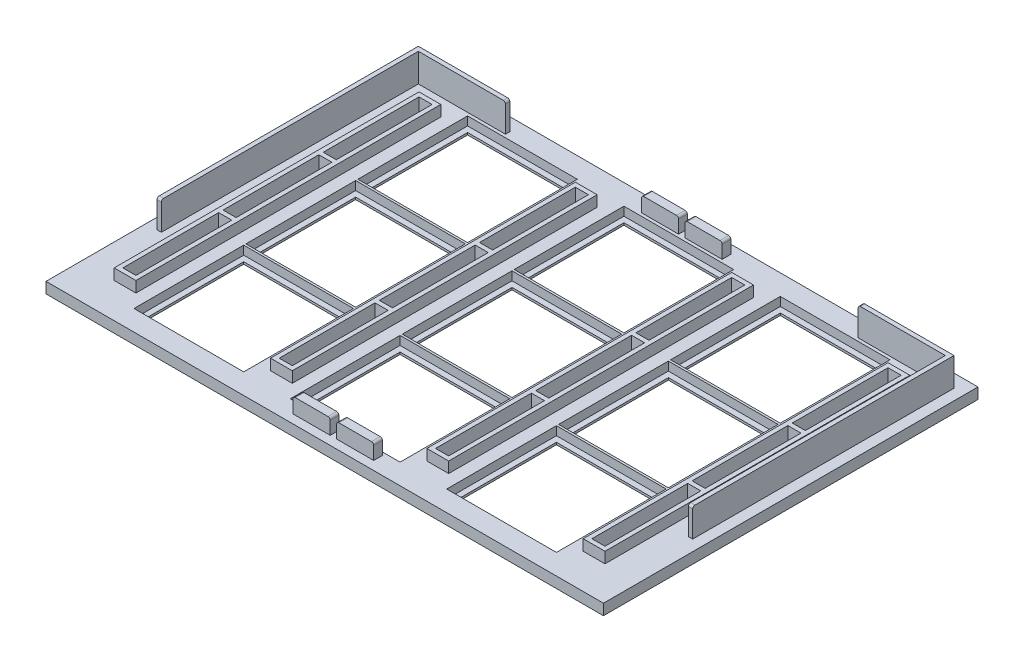
from build123d import *

# Parameters (mm, degrees)
SKETCH2_W           = 128
SKETCH2_H           = 86
BOSS_EXTRUDE1_DEPTH = 2.5
SKETCH3_W           = 25.2
SKETCH3_H           = 25.2
SKETCH3_H_2         = 12.6
CUT_EXTRUDE1_DEPTH  = 2
SKETCH4_W           = 22.6
SKETCH4_H           = 22.6
CUT_EXTRUDE2_DEPTH  = 2.5
SKETCH5_W           = 5
SKETCH5_H           = 70
BOSS_EXTRUDE2_DEPTH = 2.5
SKETCH7_W           = 3
SKETCH7_H           = 22
CUT_EXTRUDE6_DEPTH  = 3
SKETCH9_W           = 8.5
SKETCH9_H           = 2
BOSS_EXTRUDE3_DEPTH = 6.5
CUT_EXTRUDE9_START  = 3.5
SKETCH10_W          = 8.5
SKETCH10_H          = 2
CUT_EXTRUDE9_DEPTH  = 74.877322259
FILLET1_R           = 0.5


with BuildPart() as part:
    # Sketch2 → Boss-Extrude1 (new body)
    with BuildSketch(Plane(origin=(0, 0, 0), x_dir=(1, 0, 0), z_dir=(0, 1, 0))):
        Rectangle(SKETCH2_W, SKETCH2_H)
    extrude(amount=-BOSS_EXTRUDE1_DEPTH)

    # Sketch3 → Cut-Extrude1 (cut)
    with BuildSketch(Plane(origin=(0, 0, 0), x_dir=(1, 0, 0), z_dir=(0, 1, 0))):
        with Locations((0, 25.7)):
            Rectangle(SKETCH3_W, SKETCH3_H)
        with Locations((35.9, 25.7)):
            Rectangle(SKETCH3_W, SKETCH3_H)
        with Locations((35.9, 6.3)):
            Rectangle(SKETCH3_W, SKETCH3_H_2)
        with Locations((35.9, -6.3)):
            Rectangle(SKETCH3_W, SKETCH3_H_2)
        with Locations((35.9, -25.7)):
            Rectangle(SKETCH3_W, SKETCH3_H)
        with Locations((0, 6.3)):
            Rectangle(SKETCH3_W, SKETCH3_H_2)
        with Locations((0, -6.3)):
            Rectangle(SKETCH3_W, SKETCH3_H_2)
        with Locations((0, -25.7)):
            Rectangle(SKETCH3_W, SKETCH3_H)
        with Locations((-35.9, 25.7)):
            Rectangle(SKETCH3_W, SKETCH3_H)
        with Locations((-35.9, 6.3)):
            Rectangle(SKETCH3_W, SKETCH3_H_2)
        with Locations((-35.9, -6.3)):
            Rectangle(SKETCH3_W, SKETCH3_H_2)
        with Locations((-35.9, -25.7)):
            Rectangle(SKETCH3_W, SKETCH3_H)
    extrude(amount=-CUT_EXTRUDE1_DEPTH, mode=Mode.SUBTRACT)

    # Sketch4 → Cut-Extrude2 (cut)
    with BuildSketch(Plane(origin=(0, 0, 0), x_dir=(1, 0, 0), z_dir=(0, 1, 0))):
        Rectangle(SKETCH4_W, SKETCH4_H)
        with Locations((0, 25.7)):
            Rectangle(SKETCH4_W, SKETCH4_H)
        with Locations((0, -25.7)):
            Rectangle(SKETCH4_W, SKETCH4_H)
        with Locations((35.9, -25.7)):
            Rectangle(SKETCH4_W, SKETCH4_H)
        with Locations((35.9, 0)):
            Rectangle(SKETCH4_W, SKETCH4_H)
        with Locations((35.9, 25.7)):
            Rectangle(SKETCH4_W, SKETCH4_H)
        with Locations((-35.9, -25.7)):
            Rectangle(SKETCH4_W, SKETCH4_H)
        with Locations((-35.9, 0)):
            Rectangle(SKETCH4_W, SKETCH4_H)
        with Locations((-35.9, 25.7)):
            Rectangle(SKETCH4_W, SKETCH4_H)
    extrude(amount=-CUT_EXTRUDE2_DEPTH, mode=Mode.SUBTRACT)

    # Sketch5 → Boss-Extrude2 (add)
    with BuildSketch(Plane(origin=(0, 0, 0), x_dir=(1, 0, 0), z_dir=(0, 1, 0))):
        with Locations((-53.85, 0)):
            Rectangle(SKETCH5_W, SKETCH5_H)
        with Locations((-17.95, 0)):
            Rectangle(SKETCH5_W, SKETCH5_H)
        with Locations((17.95, 0)):
            Rectangle(SKETCH5_W, SKETCH5_H)
        with Locations((53.85, 0)):
            Rectangle(SKETCH5_W, SKETCH5_H)
    extrude(amount=BOSS_EXTRUDE2_DEPTH)

    # Sketch7 → Cut-Extrude6 (cut)
    with BuildSketch(Plane(origin=(0, 2.5, 0), x_dir=(1, 0, 0), z_dir=(0, 1, 0))):
        with Locations((-17.95, 23)):
            Rectangle(SKETCH7_W, SKETCH7_H)
        with Locations((-17.95, 0)):
            Rectangle(SKETCH7_W, SKETCH7_H)
        with Locations((-17.95, -23)):
            Rectangle(SKETCH7_W, SKETCH7_H)
        with Locations((17.95, 23)):
            Rectangle(SKETCH7_W, SKETCH7_H)
        with Locations((17.95, 0)):
            Rectangle(SKETCH7_W, SKETCH7_H)
        with Locations((17.95, -23)):
            Rectangle(SKETCH7_W, SKETCH7_H)
        with Locations((53.85, 23)):
            Rectangle(SKETCH7_W, SKETCH7_H)
        with Locations((53.85, 0)):
            Rectangle(SKETCH7_W, SKETCH7_H)
        with Locations((-53.85, 23)):
            Rectangle(SKETCH7_W, SKETCH7_H)
        with Locations((-53.85, 0)):
            Rectangle(SKETCH7_W, SKETCH7_H)
        with Locations((-53.85, -23)):
            Rectangle(SKETCH7_W, SKETCH7_H)
        with Locations((53.85, -23)):
            Rectangle(SKETCH7_W, SKETCH7_H)
    extrude(amount=-CUT_EXTRUDE6_DEPTH, mode=Mode.SUBTRACT)

    # Sketch9 → Boss-Extrude3 (add)
    with BuildSketch(Plane(origin=(0, 0, 0), x_dir=(1, 0, 0), z_dir=(0, 1, 0))):
        Polygon((-61.5, -20), (-60.5, -20), (-60.5, 39), (-40.5, 39), (-40.5, 40), (-61.5, 40), align=None)
        Polygon((40.5, 40), (61.5, 40), (61.5, -20), (60.5, -20), (60.5, 39), (40.5, 39), align=None)
        with Locations((-5, 40)):
            Rectangle(SKETCH9_W, SKETCH9_H)
        with Locations((5, 40)):
            Rectangle(SKETCH9_W, SKETCH9_H)
        with Locations((-5, -40)):
            Rectangle(SKETCH9_W, SKETCH9_H)
        with Locations((5, -40)):
            Rectangle(SKETCH9_W, SKETCH9_H)
    extrude(amount=BOSS_EXTRUDE3_DEPTH)

    # Sketch10 → Cut-Extrude9 (cut, through all)
    with BuildSketch(Plane(origin=(0, 0, 0), x_dir=(1, 0, 0), z_dir=(0, 1, 0)).offset(CUT_EXTRUDE9_START)):
        with Locations((-5, 40)):
            Rectangle(SKETCH10_W, SKETCH10_H)
        with Locations((5, 40)):
            Rectangle(SKETCH10_W, SKETCH10_H)
        with Locations((-5, -40)):
            Rectangle(SKETCH10_W, SKETCH10_H)
        with Locations((5, -40)):
            Rectangle(SKETCH10_W, SKETCH10_H)
    extrude(amount=CUT_EXTRUDE9_DEPTH, mode=Mode.SUBTRACT)

    # Fillet1
    fillet1_edges = [part.edges().sort_by_distance(p)[0] for p in [
        (40.5, 6.5, -39.5),
        (61, 6.5, 20),
        (-61, 6.5, 20),
        (-40.5, 6.5, -39.5),
        (0.75, 3.5, -40),
        (9.25, 3.5, -40),
        (-9.25, 3.5, 40),
        (-0.75, 3.5, 40),
        (0.75, 3.5, 40),
        (9.25, 3.5, 40),
        (-9.25, 3.5, -40),
        (-0.75, 3.5, -40),
    ]]
    fillet(fillet1_edges, radius=FILLET1_R)


solid = part.part
